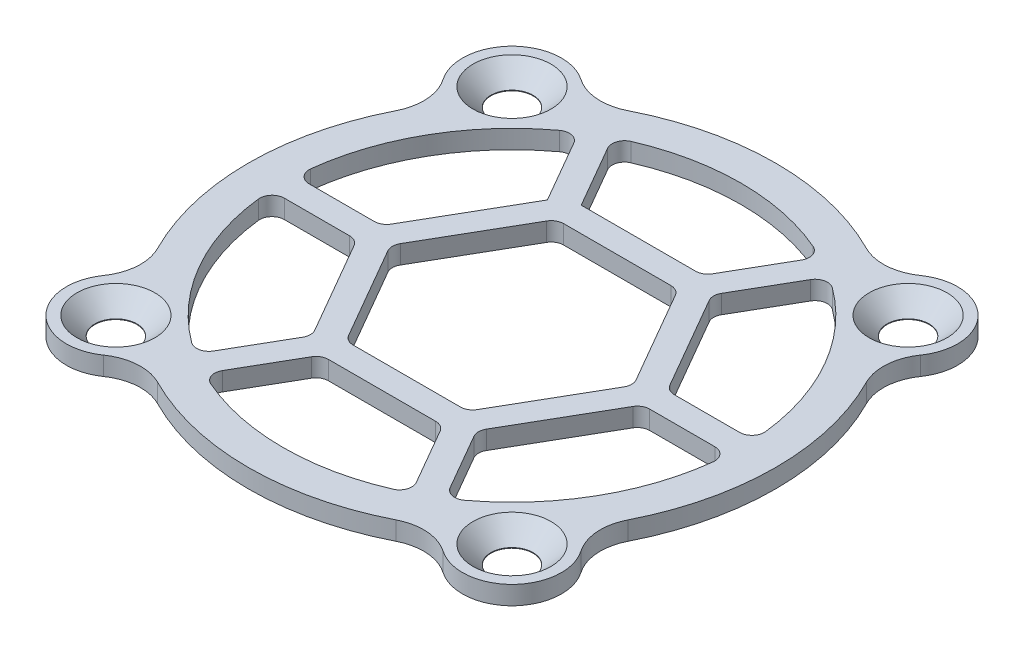
from build123d import *

# Parameters (mm, degrees)
BOSS_EXTRU_1_DEPTH                          = 1.5
FRAISAGE_POUR_VIS_T_TE_FRAIS_E_M31_AT_COUNT = 2
FRAISAGE_POUR_VIS_T_TE_FRAIS_E_M31_AT_PITCH = 32
FRAISAGE_POUR_VIS_T_TE_FRAIS_E_M31_2_COUNT  = 2
FRAISAGE_POUR_VIS_T_TE_FRAIS_E_M31_2_PITCH  = 45.254833996
FRAISAGE_POUR_VIS_T_TE_FRAIS_E_M31_3_COUNT  = 2
FRAISAGE_POUR_VIS_T_TE_FRAIS_E_M31_3_PITCH  = 32
BOSS_EXTRU_2_DEPTH                          = 1.5
CONG_1_R                                    = 4
CONG_2_R                                    = 1


with BuildPart() as part:
    # Esquisse1 → Boss.-Extru.1 (new body)
    with BuildSketch(Plane(origin=(0, 0, 0), x_dir=(1, 0, 0), z_dir=(0, 1, 0))):
        with BuildLine():
            Line((-11.964983571, 17.62183782), (-13.171572875, 18.828427125))
            ThreePointArc((-13.171572875, 18.828427125), (-18.828427125, 18.828427125), (-18.828427125, 13.171572875))
            Line((-18.828427125, 13.171572875), (-17.62183782, 11.964983571))
            ThreePointArc((-17.62183782, 11.964983571), (-15.061374439, 15.061374439), (-11.964983571, 17.62183782))
        make_face()
        with BuildLine():
            Line((-15.600466899, 9.94361265), (-17.62183782, 11.964983571))
            ThreePointArc((-17.62183782, 11.964983571), (-21.3, 0), (-17.62183782, -11.964983571))
            Line((-17.62183782, -11.964983571), (-15.600466899, -9.94361265))
            ThreePointArc((-15.600466899, -9.94361265), (-18.5, 0), (-15.600466899, 9.94361265))
        make_face()
        with BuildLine():
            Line((-9.94361265, 15.600466899), (-11.964983571, 17.62183782))
            ThreePointArc((-11.964983571, 17.62183782), (-15.061374439, 15.061374439), (-17.62183782, 11.964983571))
            Line((-17.62183782, 11.964983571), (-15.600466899, 9.94361265))
            ThreePointArc((-15.600466899, 9.94361265), (-13.081475452, 13.081475452), (-9.94361265, 15.600466899))
        make_face()
        with BuildLine():
            Line((17.62183782, -11.964983571), (15.600466899, -9.94361265))
            ThreePointArc((15.600466899, -9.94361265), (13.081475452, -13.081475452), (9.94361265, -15.600466899))
            Line((9.94361265, -15.600466899), (11.964983571, -17.62183782))
            ThreePointArc((11.964983571, -17.62183782), (15.061374439, -15.061374439), (17.62183782, -11.964983571))
        make_face()
        with BuildLine():
            ThreePointArc((11.964983571, 17.62183782), (0, 21.3), (-11.964983571, 17.62183782))
            Line((-11.964983571, 17.62183782), (-9.94361265, 15.600466899))
            ThreePointArc((-9.94361265, 15.600466899), (0, 18.5), (9.94361265, 15.600466899))
            Line((9.94361265, 15.600466899), (11.964983571, 17.62183782))
        make_face()
        with BuildLine():
            Line((13.171572875, 18.828427125), (11.964983571, 17.62183782))
            ThreePointArc((11.964983571, 17.62183782), (15.061374439, 15.061374439), (17.62183782, 11.964983571))
            Line((17.62183782, 11.964983571), (18.828427125, 13.171572875))
            ThreePointArc((18.828427125, 13.171572875), (18.828427125, 18.828427125), (13.171572875, 18.828427125))
        make_face()
        with BuildLine():
            ThreePointArc((17.62183782, 11.964983571), (15.061374439, 15.061374439), (11.964983571, 17.62183782))
            Line((11.964983571, 17.62183782), (9.94361265, 15.600466899))
            ThreePointArc((9.94361265, 15.600466899), (13.081475452, 13.081475452), (15.600466899, 9.94361265))
            Line((15.600466899, 9.94361265), (17.62183782, 11.964983571))
        make_face()
        with BuildLine():
            Line((-15.600466899, -9.94361265), (-17.62183782, -11.964983571))
            ThreePointArc((-17.62183782, -11.964983571), (-15.061374439, -15.061374439), (-11.964983571, -17.62183782))
            Line((-11.964983571, -17.62183782), (-9.94361265, -15.600466899))
            ThreePointArc((-9.94361265, -15.600466899), (-13.081475452, -13.081475452), (-15.600466899, -9.94361265))
        make_face()
        with BuildLine():
            ThreePointArc((21.3, 0), (20.359704634, 6.258787999), (17.62183782, 11.964983571))
            Line((17.62183782, 11.964983571), (15.600466899, 9.94361265))
            ThreePointArc((15.600466899, 9.94361265), (17.760329919, 5.178868716), (18.5, 0))
            ThreePointArc((18.5, 0), (17.760329919, -5.178868716), (15.600466899, -9.94361265))
            Line((15.600466899, -9.94361265), (17.62183782, -11.964983571))
            ThreePointArc((17.62183782, -11.964983571), (20.359704634, -6.258787999), (21.3, 0))
        make_face()
        with BuildLine():
            ThreePointArc((-11.964983571, -17.62183782), (-15.061374439, -15.061374439), (-17.62183782, -11.964983571))
            Line((-17.62183782, -11.964983571), (-18.828427125, -13.171572875))
            ThreePointArc((-18.828427125, -13.171572875), (-18.828427125, -18.828427125), (-13.171572875, -18.828427125))
            Line((-13.171572875, -18.828427125), (-11.964983571, -17.62183782))
        make_face()
        with BuildLine():
            Line((-9.94361265, -15.600466899), (-11.964983571, -17.62183782))
            ThreePointArc((-11.964983571, -17.62183782), (0, -21.3), (11.964983571, -17.62183782))
            Line((11.964983571, -17.62183782), (9.94361265, -15.600466899))
            ThreePointArc((9.94361265, -15.600466899), (0, -18.5), (-9.94361265, -15.600466899))
        make_face()
        with BuildLine():
            Line((18.828427125, -13.171572875), (17.62183782, -11.964983571))
            ThreePointArc((17.62183782, -11.964983571), (15.061374439, -15.061374439), (11.964983571, -17.62183782))
            Line((11.964983571, -17.62183782), (13.171572875, -18.828427125))
            ThreePointArc((13.171572875, -18.828427125), (18.828427125, -18.828427125), (18.828427125, -13.171572875))
        make_face()
    extrude(amount=BOSS_EXTRU_1_DEPTH)

    # Esquisse3 → Fraisage pour vis à tête fraisée M31 (revolve, cut)
    with BuildSketch(Plane(origin=(-16, 1.5, -16), x_dir=(0, 0, 1), z_dir=(1, 0, 0))):
        Polygon((0, 0), (0, 1.5), (1.7, 1.5), (1.7, 1.45), (3.15, 0), align=None)
    fraisage_pour_vis_t_te_frais_e_m31 = revolve(axis=Axis((-16, 7.85, -16), (0, -1, 0)), mode=Mode.SUBTRACT)

    # Fraisage pour vis à tête fraisée M31 at: Fraisage pour vis à tête fraisée M31 ×2
    with Locations(*[(i * FRAISAGE_POUR_VIS_T_TE_FRAIS_E_M31_AT_PITCH, 0, 0) for i in range(1, FRAISAGE_POUR_VIS_T_TE_FRAIS_E_M31_AT_COUNT)]):
        add(fraisage_pour_vis_t_te_frais_e_m31, mode=Mode.SUBTRACT)

    # Fraisage pour vis _ t_te frais_e M31 2: Fraisage pour vis à tête fraisée M31 ×2
    with Locations(*[Vector(0.7071067811865477, 0, 0.7071067811865475) * (i * FRAISAGE_POUR_VIS_T_TE_FRAIS_E_M31_2_PITCH) for i in range(1, FRAISAGE_POUR_VIS_T_TE_FRAIS_E_M31_2_COUNT)]):
        add(fraisage_pour_vis_t_te_frais_e_m31, mode=Mode.SUBTRACT)

    # Fraisage pour vis _ t_te frais_e M31 3: Fraisage pour vis à tête fraisée M31 ×2
    with Locations(*[(0, 0, i * FRAISAGE_POUR_VIS_T_TE_FRAIS_E_M31_3_PITCH) for i in range(1, FRAISAGE_POUR_VIS_T_TE_FRAIS_E_M31_3_COUNT)]):
        add(fraisage_pour_vis_t_te_frais_e_m31, mode=Mode.SUBTRACT)

    # Esquisse4 → Boss.-Extru.2 (add)
    with BuildSketch(Plane(origin=(0, 0, 0), x_dir=(1, 0, 0), z_dir=(0, 1, 0))):
        with BuildLine():
            Line((-6.639528096, 9.5), (-6.062177826, 10.5))
            Line((-6.062177826, 10.5), (-4.907477288, 10.5))
            Line((-4.907477288, 10.5), (-8.370451197, 16.498046756))
            ThreePointArc((-8.370451197, 16.498046756), (-9.25, 16.02146997), (-10.102502005, 15.498046756))
            Line((-10.102502005, 15.498046756), (-6.639528096, 9.5))
        make_face()
        Polygon((-4.907477288, 10.5), (-6.062177826, 10.5), (-6.639528096, 9.5), (-6.062177826, 8.5), (-4.907477288, 8.5), (-4.330127019, 9.5), align=None)
        Polygon((4.907477288, 10.5), (-4.907477288, 10.5), (-4.330127019, 9.5), (-4.907477288, 8.5), (4.907477288, 8.5), (4.330127019, 9.5), align=None)
        Polygon((-6.062177826, 8.5), (-6.639528096, 9.5), (-11.547005384, 1), (-10.392304845, 1), (-9.814954576, 0), (-4.907477288, 8.5), align=None)
        with BuildLine():
            Line((-12.124355653, 0), (-11.547005384, 1))
            Line((-11.547005384, 1), (-18.472953202, 1))
            ThreePointArc((-18.472953202, 1), (-18.5, 0), (-18.472953202, -1))
            Line((-18.472953202, -1), (-11.547005384, -1))
            Line((-11.547005384, -1), (-12.124355653, 0))
        make_face()
        Polygon((-10.392304845, 1), (-11.547005384, 1), (-12.124355653, 0), (-11.547005384, -1), (-10.392304845, -1), (-9.814954576, 0), align=None)
        with BuildLine():
            Line((-6.062177826, -10.5), (-6.639528096, -9.5))
            Line((-6.639528096, -9.5), (-10.102502005, -15.498046756))
            ThreePointArc((-10.102502005, -15.498046756), (-9.25, -16.02146997), (-8.370451197, -16.498046756))
            Line((-8.370451197, -16.498046756), (-4.907477288, -10.5))
            Line((-4.907477288, -10.5), (-6.062177826, -10.5))
        make_face()
        Polygon((-10.392304845, -1), (-11.547005384, -1), (-6.639528096, -9.5), (-6.062177826, -8.5), (-4.907477288, -8.5), (-9.814954576, 0), align=None)
        Polygon((-6.062177826, -8.5), (-6.639528096, -9.5), (-6.062177826, -10.5), (-4.907477288, -10.5), (-4.330127019, -9.5), (-4.907477288, -8.5), align=None)
        Polygon((4.907477288, -8.5), (-4.907477288, -8.5), (-4.330127019, -9.5), (-4.907477288, -10.5), (4.907477288, -10.5), (4.330127019, -9.5), align=None)
        Polygon((6.062177826, -8.5), (4.907477288, -8.5), (4.330127019, -9.5), (4.907477288, -10.5), (6.062177826, -10.5), (6.639528096, -9.5), align=None)
        with BuildLine():
            Line((4.907477288, -10.5), (8.370451197, -16.498046756))
            ThreePointArc((8.370451197, -16.498046756), (9.25, -16.02146997), (10.102502005, -15.498046756))
            Line((10.102502005, -15.498046756), (6.639528096, -9.5))
            Line((6.639528096, -9.5), (6.062177826, -10.5))
            Line((6.062177826, -10.5), (4.907477288, -10.5))
        make_face()
        Polygon((10.392304845, -1), (9.814954576, 0), (4.907477288, -8.5), (6.062177826, -8.5), (6.639528096, -9.5), (11.547005384, -1), align=None)
        Polygon((6.062177826, 8.5), (4.907477288, 8.5), (9.814954576, 0), (10.392304845, 1), (11.547005384, 1), (6.639528096, 9.5), align=None)
        Polygon((10.392304845, 1), (9.814954576, 0), (10.392304845, -1), (11.547005384, -1), (12.124355653, 0), (11.547005384, 1), align=None)
        with BuildLine():
            Line((18.472953202, 1), (11.547005384, 1))
            Line((11.547005384, 1), (12.124355653, 0))
            Line((12.124355653, 0), (11.547005384, -1))
            Line((11.547005384, -1), (18.472953202, -1))
            ThreePointArc((18.472953202, -1), (18.493237064, -0.500182849), (18.5, 0))
            ThreePointArc((18.5, 0), (18.493237064, 0.500182849), (18.472953202, 1))
        make_face()
        Polygon((6.062177826, 10.5), (4.907477288, 10.5), (4.330127019, 9.5), (4.907477288, 8.5), (6.062177826, 8.5), (6.639528096, 9.5), align=None)
        with BuildLine():
            Line((8.370451197, 16.498046756), (4.907477288, 10.5))
            Line((4.907477288, 10.5), (6.062177826, 10.5))
            Line((6.062177826, 10.5), (6.639528096, 9.5))
            Line((6.639528096, 9.5), (10.102502005, 15.498046756))
            ThreePointArc((10.102502005, 15.498046756), (9.25, 16.02146997), (8.370451197, 16.498046756))
        make_face()
    extrude(amount=BOSS_EXTRU_2_DEPTH)

    # Congé1
    cong_1_edges = [part.edges().sort_by_distance(p)[0] for p in [
        (-17.62183782, 0.75, -11.964983571),
        (11.964983571, 0.75, 17.62183782),
        (-11.964983571, 0.75, 17.62183782),
        (17.62183782, 0.75, -11.964983571),
        (-17.62183782, 0.75, 11.964983571),
        (11.964983571, 0.75, -17.62183782),
        (-11.964983571, 0.75, -17.62183782),
        (17.62183782, 0.75, 11.964983571),
    ]]
    fillet(cong_1_edges, radius=CONG_1_R)

    # Congé2
    cong_2_edges = [part.edges().sort_by_distance(p)[0] for p in [
        (-4.907477288, 0.75, -8.5),
        (4.907477288, 0.75, -8.5),
        (9.814954576, 0.75, 0),
        (4.907477288, 0.75, 8.5),
        (-4.907477288, 0.75, 8.5),
        (11.547005384, 0.75, -1),
        (6.639528096, 0.75, -9.5),
        (10.102502005, 0.75, -15.498046756),
        (8.370451197, 0.75, -16.498046756),
        (4.907477288, 0.75, -10.5),
        (-8.370451197, 0.75, -16.498046756),
        (-10.102502005, 0.75, -15.498046756),
        (-11.547005384, 0.75, -1),
        (-18.472953202, 0.75, -1),
        (-18.472953202, 0.75, 1),
        (-11.547005384, 0.75, 1),
        (-6.639528096, 0.75, 9.5),
        (-10.102502005, 0.75, 15.498046756),
        (-8.370451197, 0.75, 16.498046756),
        (-4.907477288, 0.75, 10.5),
        (4.907477288, 0.75, 10.5),
        (8.370451197, 0.75, 16.498046756),
        (10.102502005, 0.75, 15.498046756),
        (6.639528096, 0.75, 9.5),
        (11.547005384, 0.75, 1),
        (18.472953202, 0.75, 1),
        (18.472953202, 0.75, -1),
        (-9.814954576, 0.75, 0),
    ]]
    fillet(cong_2_edges, radius=CONG_2_R)


solid = part.part
